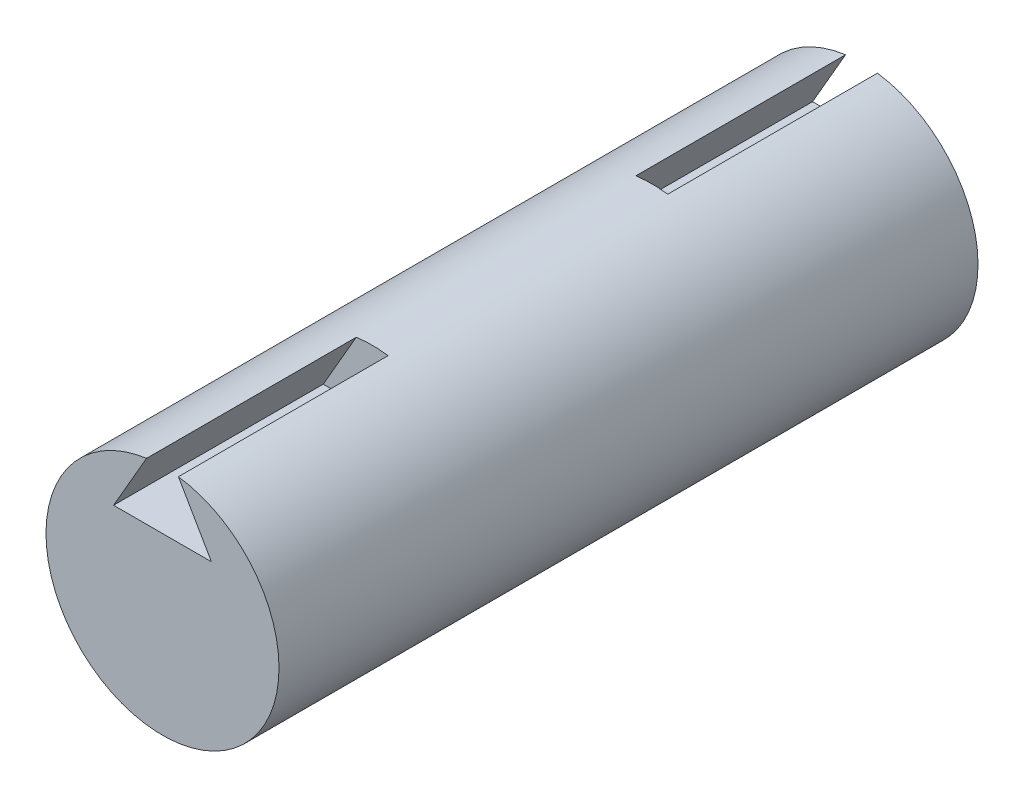
from build123d import *

# Parameters (mm, degrees)
BOSS_EXTRUDE1_DEPTH = 3
BOSS_EXTRUDE2_START = 0.9
SKETCH1_7_R         = 0.5
BOSS_EXTRUDE2_DEPTH = 1.2


with BuildPart() as part:
    # Sketch1 → Boss-Extrude1 (new body)
    with BuildSketch(Plane.XY):
        with BuildLine():
            Line((0.21, 0.25), (0, 0.25))
            Line((0, 0.25), (-0.21, 0.25))
            Line((-0.21, 0.25), (-0.06837431, 0.495302891))
            ThreePointArc((-0.06837431, 0.495302891), (-0.32849113, -0.376953018), (0.5, 0))
            ThreePointArc((0.5, 0), (0.376953018, 0.32849113), (0.06837431, 0.495302891))
            Line((0.06837431, 0.495302891), (0.21, 0.25))
        make_face()
    extrude(amount=BOSS_EXTRUDE1_DEPTH)

    # Sketch1<7> → Boss-Extrude2 (add)
    with BuildSketch(Plane.XY.offset(BOSS_EXTRUDE2_START)):
        Circle(SKETCH1_7_R)
    extrude(amount=BOSS_EXTRUDE2_DEPTH)


solid = part.part
